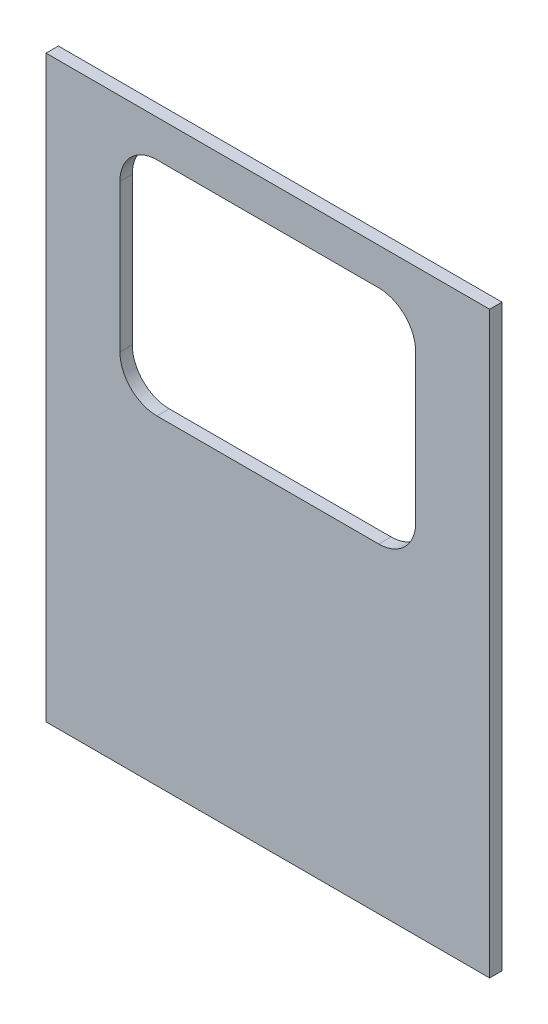
from build123d import *

# Parameters (mm, degrees)
SKETCH1_W           = 914.4
SKETCH1_H           = 1193.8
SKETCH1_W_2         = 609.6
SKETCH1_H_2         = 457.2
BOSS_EXTRUDE1_DEPTH = 25.4
FILLET1_R           = 76.2


with BuildPart() as part:
    # Sketch1 → Boss-Extrude1 (new body)
    with BuildSketch(Plane.XY):
        Rectangle(SKETCH1_W, SKETCH1_H)
        with Locations((0, 292.1)):
            Rectangle(SKETCH1_W_2, SKETCH1_H_2, mode=Mode.SUBTRACT)
    extrude(amount=BOSS_EXTRUDE1_DEPTH)

    # Fillet1
    fillet1_edges = [part.edges().sort_by_distance(p)[0] for p in [
        (304.8, 63.5, 12.7),
        (304.8, 520.7, 12.7),
        (-304.8, 520.7, 12.7),
        (-304.8, 63.5, 12.7),
    ]]
    fillet(fillet1_edges, radius=FILLET1_R)


solid = part.part
